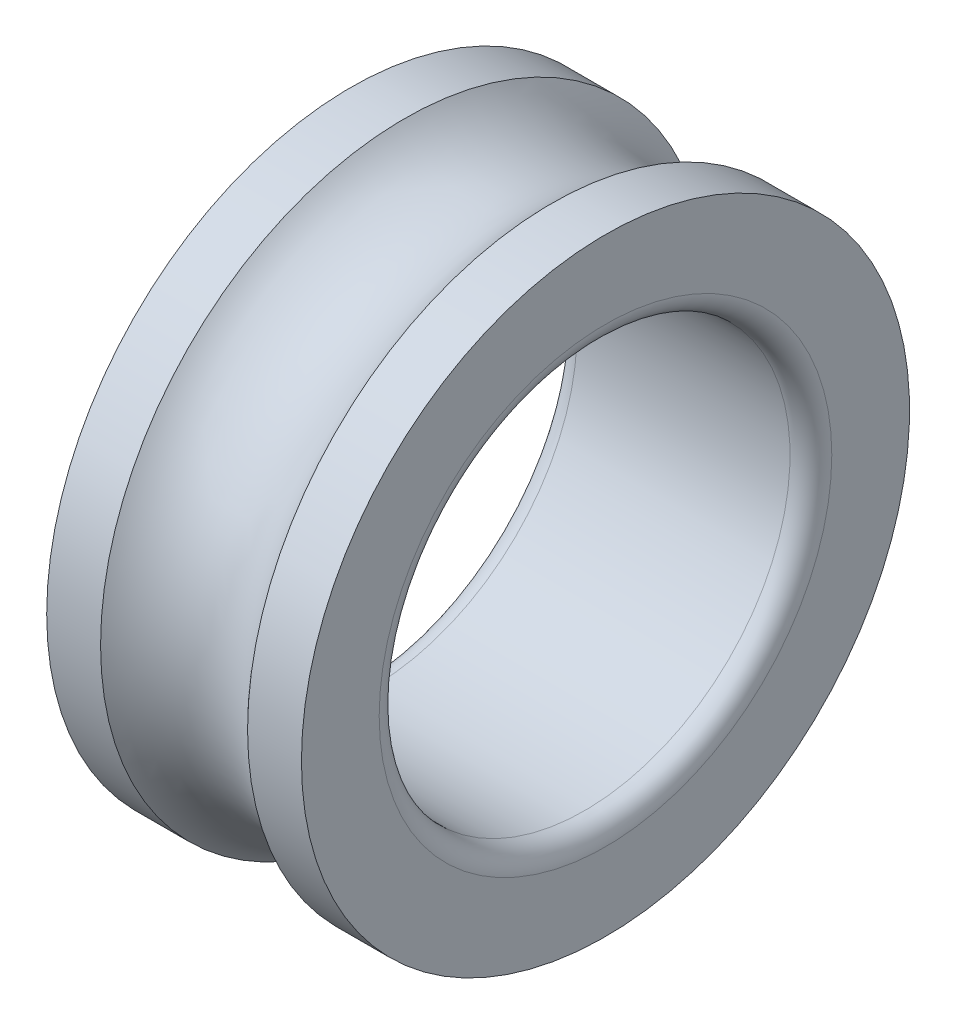
from build123d import *

# Parameters (mm, degrees)
SCALE1_SCALE = 0.35


with BuildPart() as part:
    # Sketch1 → Revolve1 (revolve)
    with BuildSketch(Plane.XY, mode=Mode.PRIVATE) as revolve1_sk:
        with BuildLine():
            Line((-15.5, 37), (-8.94427191, 37))
            ThreePointArc((-8.94427191, 37), (0, 33), (8.94427191, 37))
            Line((8.94427191, 37), (15.5, 37))
            Line((15.5, 37), (15.5, 27.54))
            ThreePointArc((15.5, 27.54), (14.756051224, 25.743948776), (12.96, 25))
            Line((12.96, 25), (-12.96, 25))
            ThreePointArc((-12.96, 25), (-14.756051224, 25.743948776), (-15.5, 27.54))
            Line((-15.5, 27.54), (-15.5, 37))
        make_face()
    revolve(revolve1_sk.sketch.rotate(Axis((-21.666666667, 0, 0), (1, 0, 0)), 90), axis=Axis((-21.666666667, 0, 0), (1, 0, 0)))


with BuildPart() as part_1:
    # Scale1: scaled about (0, 0, 0)
    add(part.part.scale(SCALE1_SCALE))


solid = part_1.part
